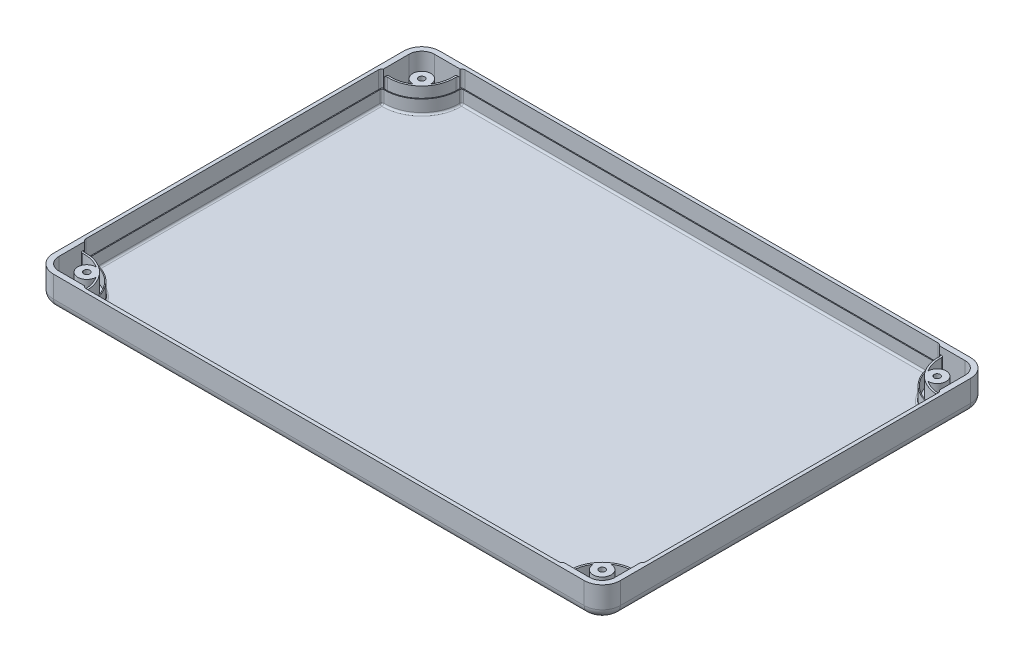
from build123d import *

# Parameters (mm, degrees)
SALIENTE_EXTRUIR1_DEPTH  = 1
SALIENTE_EXTRUIR2_DEPTH  = 16
CROQUIS8_R               = 5
CROQUIS8_R_2             = 1.7
SALIENTE_EXTRUIR7_DEPTH  = 12
SALIENTE_EXTRUIR11_DEPTH = 12
CORTAR_EXTRUIR1_START    = -12
CROQUIS11_R              = 1.7
CORTAR_EXTRUIR1_DEPTH    = 12
CORTAR_EXTRUIR2_DEPTH    = 16
SALIENTE_EXTRUIR12_DEPTH = 7.5
REDONDEO1_R              = 5
REDONDEO2_R              = 1


with BuildPart() as part:
    # Croquis1 → Saliente-Extruir1 (new body)
    with BuildSketch(Plane(origin=(0, 0, 0), x_dir=(1, 0, 0), z_dir=(0, 1, 0))):
        with BuildLine():
            Line((-147, 107), (147, 107))
            ThreePointArc((147, 107), (154.071067812, 104.071067812), (157, 97))
            Line((157, 97), (157, -97))
            ThreePointArc((157, -97), (154.071067812, -104.071067812), (147, -107))
            Line((147, -107), (-147, -107))
            ThreePointArc((-147, -107), (-154.071067812, -104.071067812), (-157, -97))
            Line((-157, -97), (-157, 97))
            ThreePointArc((-157, 97), (-154.071067812, 104.071067812), (-147, 107))
        make_face()
    extrude(amount=SALIENTE_EXTRUIR1_DEPTH)

    # Croquis2 → Saliente-Extruir2 (add)
    with BuildSketch(Plane(origin=(0, 1, 0), x_dir=(1, 0, 0), z_dir=(0, 1, 0))):
        with BuildLine():
            Line((-147, 107), (147, 107))
            ThreePointArc((147, 107), (154.071067812, 104.071067812), (157, 97))
            Line((157, 97), (157, -97))
            ThreePointArc((157, -97), (154.071067812, -104.071067812), (147, -107))
            Line((147, -107), (-147, -107))
            ThreePointArc((-147, -107), (-154.071067812, -104.071067812), (-157, -97))
            Line((-157, -97), (-157, 97))
            ThreePointArc((-157, 97), (-154.071067812, 104.071067812), (-147, 107))
        make_face()
        with BuildLine():
            Line((-154, 97), (-154, -97))
            ThreePointArc((-154, -97), (-151.949747468, -101.949747468), (-147, -104))
            Line((-147, -104), (147, -104))
            ThreePointArc((147, -104), (151.949747468, -101.949747468), (154, -97))
            Line((154, -97), (154, 97))
            ThreePointArc((154, 97), (151.949747468, 101.949747468), (147, 104))
            Line((147, 104), (-147, 104))
            ThreePointArc((-147, 104), (-151.949747468, 101.949747468), (-154, 97))
        make_face(mode=Mode.SUBTRACT)
    extrude(amount=SALIENTE_EXTRUIR2_DEPTH)

    # Croquis8 → Saliente-Extruir7 (add)
    # profile 1 of 4: a face of its own
    with BuildSketch(Plane(origin=(0, 1, 0), x_dir=(1, 0, 0), z_dir=(0, 1, 0))):
        with Locations(Location((-142.725755776, 92.789071879, 0), (0, 0, 90))):
            Circle(CROQUIS8_R)
        with Locations(Location((-142.725755776, 92.789071879, 0), (0, 0, 270))):
            Circle(CROQUIS8_R_2, mode=Mode.SUBTRACT)
    # profile 2 of 4: a face of its own
    with BuildSketch(Plane(origin=(0, 1, 0), x_dir=(1, 0, 0), z_dir=(0, 1, 0))):
        with Locations(Location((142.725755776, 92.789071879, 0), (0, 0, 90))):
            Circle(CROQUIS8_R)
        with Locations(Location((142.725755776, 92.789071879, 0), (0, 0, 90))):
            Circle(CROQUIS8_R_2, mode=Mode.SUBTRACT)
    # profile 3 of 4: a face of its own
    with BuildSketch(Plane(origin=(0, 1, 0), x_dir=(1, 0, 0), z_dir=(0, 1, 0))):
        with Locations(Location((142.725755776, -92.789071879, 0), (0, 0, 90))):
            Circle(CROQUIS8_R)
        with Locations(Location((142.725755776, -92.789071879, 0), (0, 0, 270))):
            Circle(CROQUIS8_R_2, mode=Mode.SUBTRACT)
    # profile 4 of 4: a face of its own
    with BuildSketch(Plane(origin=(0, 1, 0), x_dir=(1, 0, 0), z_dir=(0, 1, 0))):
        with Locations(Location((-142.725755776, -92.789071879, 0), (0, 0, 90))):
            Circle(CROQUIS8_R)
        with Locations(Location((-142.725755776, -92.789071879, 0), (0, 0, 90))):
            Circle(CROQUIS8_R_2, mode=Mode.SUBTRACT)
    extrude(amount=SALIENTE_EXTRUIR7_DEPTH)

    # Croquis10 → Saliente-Extruir11 (add)
    with BuildSketch(Plane(origin=(0, 1, 0), x_dir=(1, 0, 0), z_dir=(0, 1, 0))):
        with BuildLine():
            ThreePointArc((-152.944723551, 83.977267879), (-145.494930604, 85.14691023), (-139.178067155, 89.265734618))
            ThreePointArc((-139.178067155, 89.265734618), (-140.718192191, 88.209804639), (-142.538330048, 87.792585954))
            ThreePointArc((-142.538330048, 87.792585954), (-147.511107859, 85.539431249), (-152.941652637, 84.978709665))
            ThreePointArc((-152.941652637, 84.978709665), (-153.68616785, 84.707856573), (-154, 83.980413323))
            Line((-154, 83.980413323), (-154, 82.978796791))
            ThreePointArc((-154, 82.978796791), (-153.687285803, 83.705183894), (-152.944723551, 83.977267879))
        make_face()
        with BuildLine():
            Line((-132.978796791, 104), (-133.980413323, 104))
            ThreePointArc((-133.980413323, 104), (-134.707856573, 103.68616785), (-134.978709665, 102.941652637))
            ThreePointArc((-134.978709665, 102.941652637), (-135.524242151, 97.567650359), (-137.728097416, 92.636065609))
            ThreePointArc((-137.728097416, 92.636065609), (-138.132769656, 90.81309655), (-139.178067155, 89.265734618))
            ThreePointArc((-139.178067155, 89.265734618), (-135.124780111, 95.552836228), (-133.977267879, 102.944723551))
            ThreePointArc((-133.977267879, 102.944723551), (-133.705183894, 103.687285803), (-132.978796791, 104))
        make_face()
        with BuildLine():
            ThreePointArc((134.978709665, 102.941652637), (134.707856573, 103.68616785), (133.980413323, 104))
            Line((133.980413323, 104), (132.978796791, 104))
            ThreePointArc((132.978796791, 104), (133.705183894, 103.687285803), (133.977267879, 102.944723551))
            ThreePointArc((133.977267879, 102.944723551), (135.124780111, 95.552836228), (139.178067155, 89.265734618))
            ThreePointArc((139.178067155, 89.265734618), (138.132769656, 90.81309655), (137.728097416, 92.636065609))
            ThreePointArc((137.728097416, 92.636065609), (135.524242151, 97.567650359), (134.978709665, 102.941652637))
        make_face()
        with BuildLine():
            ThreePointArc((142.538330048, 87.792585954), (140.718192191, 88.209804639), (139.178067155, 89.265734618))
            ThreePointArc((139.178067155, 89.265734618), (145.494930604, 85.14691023), (152.944723551, 83.977267879))
            ThreePointArc((152.944723551, 83.977267879), (153.687285803, 83.705183894), (154, 82.978796791))
            Line((154, 82.978796791), (154, 83.980413323))
            ThreePointArc((154, 83.980413323), (153.68616785, 84.707856573), (152.941652637, 84.978709665))
            ThreePointArc((152.941652637, 84.978709665), (147.511107859, 85.539431249), (142.538330048, 87.792585954))
        make_face()
        with BuildLine():
            ThreePointArc((152.944723551, -83.977267879), (145.494930604, -85.14691023), (139.178067155, -89.265734618))
            ThreePointArc((139.178067155, -89.265734618), (140.718192191, -88.209804639), (142.538330048, -87.792585954))
            ThreePointArc((142.538330048, -87.792585954), (147.511107859, -85.539431249), (152.941652637, -84.978709665))
            ThreePointArc((152.941652637, -84.978709665), (153.68616785, -84.707856573), (154, -83.980413323))
            Line((154, -83.980413323), (154, -82.978796791))
            ThreePointArc((154, -82.978796791), (153.687285803, -83.705183894), (152.944723551, -83.977267879))
        make_face()
        with BuildLine():
            Line((132.978796791, -104), (133.980413323, -104))
            ThreePointArc((133.980413323, -104), (134.707856573, -103.68616785), (134.978709665, -102.941652637))
            ThreePointArc((134.978709665, -102.941652637), (135.524242151, -97.567650359), (137.728097416, -92.636065609))
            ThreePointArc((137.728097416, -92.636065609), (138.132769656, -90.81309655), (139.178067155, -89.265734618))
            ThreePointArc((139.178067155, -89.265734618), (135.124780111, -95.552836228), (133.977267879, -102.944723551))
            ThreePointArc((133.977267879, -102.944723551), (133.705183894, -103.687285803), (132.978796791, -104))
        make_face()
        with BuildLine():
            ThreePointArc((-134.978709665, -102.941652637), (-134.707856573, -103.68616785), (-133.980413323, -104))
            Line((-133.980413323, -104), (-132.978796791, -104))
            ThreePointArc((-132.978796791, -104), (-133.705183894, -103.687285803), (-133.977267879, -102.944723551))
            ThreePointArc((-133.977267879, -102.944723551), (-135.124780111, -95.552836228), (-139.178067155, -89.265734618))
            ThreePointArc((-139.178067155, -89.265734618), (-138.132769656, -90.81309655), (-137.728097416, -92.636065609))
            ThreePointArc((-137.728097416, -92.636065609), (-135.524242151, -97.567650359), (-134.978709665, -102.941652637))
        make_face()
        with BuildLine():
            ThreePointArc((-142.538330048, -87.792585954), (-140.718192191, -88.209804639), (-139.178067155, -89.265734618))
            ThreePointArc((-139.178067155, -89.265734618), (-145.494930604, -85.14691023), (-152.944723551, -83.977267879))
            ThreePointArc((-152.944723551, -83.977267879), (-153.687285803, -83.705183894), (-154, -82.978796791))
            Line((-154, -82.978796791), (-154, -83.980413323))
            ThreePointArc((-154, -83.980413323), (-153.68616785, -84.707856573), (-152.941652637, -84.978709665))
            ThreePointArc((-152.941652637, -84.978709665), (-147.511107859, -85.539431249), (-142.538330048, -87.792585954))
        make_face()
    extrude(amount=SALIENTE_EXTRUIR11_DEPTH)

    # Croquis11 → Cortar-Extruir1 (cut)
    with BuildSketch(Plane(origin=(0, 1, 0), x_dir=(1, 0, 0), z_dir=(0, 1, 0)).offset(CORTAR_EXTRUIR1_START)):
        with Locations(Location((142.725755776, 92.789071879, 0), (0, 0, 90))):
            Circle(CROQUIS11_R)
        with Locations(Location((-142.725755776, 92.789071879, 0), (0, 0, 90))):
            Circle(CROQUIS11_R)
        with Locations(Location((-142.725755776, -92.789071879, 0), (0, 0, 90))):
            Circle(CROQUIS11_R)
        with Locations(Location((142.725755776, -92.789071879, 0), (0, 0, 90))):
            Circle(CROQUIS11_R)
    extrude(amount=CORTAR_EXTRUIR1_DEPTH, mode=Mode.SUBTRACT)

    # Croquis13 → Cortar-Extruir2 (cut)
    with BuildSketch(Plane(origin=(0, 1, 0), x_dir=(1, 0, 0), z_dir=(0, 1, 0))):
        with BuildLine():
            Line((-130.976026539, -105), (130.976026539, -105))
            ThreePointArc((130.976026539, -105), (132.425172512, -104.378396151), (132.97352377, -102.899975949))
            ThreePointArc((132.97352377, -102.899975949), (138.514718626, -88.514718626), (152.899975949, -82.97352377))
            ThreePointArc((152.899975949, -82.97352377), (154.378396151, -82.425172512), (155, -80.976026539))
            Line((155, -80.976026539), (155, 80.976026539))
            ThreePointArc((155, 80.976026539), (154.378396151, 82.425172512), (152.899975949, 82.97352377))
            ThreePointArc((152.899975949, 82.97352377), (138.514718626, 88.514718626), (132.97352377, 102.899975949))
            ThreePointArc((132.97352377, 102.899975949), (132.425172512, 104.378396151), (130.976026539, 105))
            Line((130.976026539, 105), (-130.976026539, 105))
            ThreePointArc((-130.976026539, 105), (-132.425172512, 104.378396151), (-132.97352377, 102.899975949))
            ThreePointArc((-132.97352377, 102.899975949), (-138.514718626, 88.514718626), (-152.899975949, 82.97352377))
            ThreePointArc((-152.899975949, 82.97352377), (-154.378396151, 82.425172512), (-155, 80.976026539))
            Line((-155, 80.976026539), (-155, -80.976026539))
            ThreePointArc((-155, -80.976026539), (-154.378396151, -82.425172512), (-152.899975949, -82.97352377))
            ThreePointArc((-152.899975949, -82.97352377), (-138.514718626, -88.514718626), (-132.97352377, -102.899975949))
            ThreePointArc((-132.97352377, -102.899975949), (-132.425172512, -104.378396151), (-130.976026539, -105))
        make_face()
    extrude(amount=CORTAR_EXTRUIR2_DEPTH, mode=Mode.SUBTRACT)

    # Croquis14 → Saliente-Extruir12 (add)
    with BuildSketch(Plane(origin=(0, 1, 0), x_dir=(1, 0, 0), z_dir=(0, 1, 0))):
        with BuildLine():
            Line((154, 80.976026539), (154, -80.976026539))
            ThreePointArc((154, -80.976026539), (153.689198076, -81.700599525), (152.949987975, -81.974775155))
            ThreePointArc((152.949987975, -81.974775155), (137.807611845, -87.807611845), (131.974775155, -102.949987975))
            ThreePointArc((131.974775155, -102.949987975), (131.700599525, -103.689198076), (130.976026539, -104))
            Line((130.976026539, -104), (-130.976026539, -104))
            ThreePointArc((-130.976026539, -104), (-131.700599525, -103.689198076), (-131.974775155, -102.949987975))
            ThreePointArc((-131.974775155, -102.949987975), (-137.807611845, -87.807611845), (-152.949987975, -81.974775155))
            ThreePointArc((-152.949987975, -81.974775155), (-153.689198076, -81.700599525), (-154, -80.976026539))
            Line((-154, -80.976026539), (-154, 80.976026539))
            ThreePointArc((-154, 80.976026539), (-153.689198076, 81.700599525), (-152.949987975, 81.974775155))
            ThreePointArc((-152.949987975, 81.974775155), (-137.807611845, 87.807611845), (-131.974775155, 102.949987975))
            ThreePointArc((-131.974775155, 102.949987975), (-131.700599525, 103.689198076), (-130.976026539, 104))
            Line((-130.976026539, 104), (130.976026539, 104))
            ThreePointArc((130.976026539, 104), (131.700599525, 103.689198076), (131.974775155, 102.949987975))
            ThreePointArc((131.974775155, 102.949987975), (137.807611845, 87.807611845), (152.949987975, 81.974775155))
            ThreePointArc((152.949987975, 81.974775155), (153.689198076, 81.700599525), (154, 80.976026539))
        make_face()
        with BuildLine():
            ThreePointArc((152.474406859, 81.456462409), (137.454058454, 87.454058454), (131.456462409, 102.47440686))
            ThreePointArc((131.456462409, 102.47440686), (131.172888124, 103.197999592), (130.456789967, 103.500000001))
            Line((130.456789967, 103.500000001), (-130.456789967, 103.500000001))
            ThreePointArc((-130.456789967, 103.500000001), (-131.172888124, 103.197999592), (-131.456462409, 102.47440686))
            ThreePointArc((-131.456462409, 102.47440686), (-137.454058454, 87.454058454), (-152.474406859, 81.456462409))
            ThreePointArc((-152.474406859, 81.456462409), (-153.197999591, 81.172888124), (-153.5, 80.456789967))
            Line((-153.5, 80.456789967), (-153.5, -80.456789967))
            ThreePointArc((-153.5, -80.456789967), (-153.197999591, -81.172888124), (-152.474406859, -81.456462409))
            ThreePointArc((-152.474406859, -81.456462409), (-137.454058454, -87.454058454), (-131.456462409, -102.474406858))
            ThreePointArc((-131.456462409, -102.474406858), (-131.172888124, -103.197999591), (-130.456789967, -103.499999999))
            Line((-130.456789967, -103.499999999), (130.456789967, -103.499999999))
            ThreePointArc((130.456789967, -103.499999999), (131.172888124, -103.197999591), (131.456462409, -102.474406858))
            ThreePointArc((131.456462409, -102.474406858), (137.454058454, -87.454058454), (152.474406859, -81.456462409))
            ThreePointArc((152.474406859, -81.456462409), (153.197999591, -81.172888124), (153.5, -80.456789967))
            Line((153.5, -80.456789967), (153.5, 80.456789967))
            ThreePointArc((153.5, 80.456789967), (153.197999591, 81.172888124), (152.474406859, 81.456462409))
        make_face(mode=Mode.SUBTRACT)
    extrude(amount=SALIENTE_EXTRUIR12_DEPTH)

    # Redondeo1
    redondeo1_edges = [part.edges().sort_by_distance(p)[0] for p in [
        (0, 0, 107),
        (-154.071067812, 0, 104.071067812),
        (-157, 0, 0),
        (-154.071067812, 0, -104.071067812),
        (0, 0, -107),
        (154.071067812, 0, -104.071067812),
        (157, 0, 0),
        (154.071067812, 0, 104.071067812),
    ]]
    fillet(redondeo1_edges, radius=REDONDEO1_R)

    # Redondeo2
    redondeo2_edges = [part.edges().sort_by_distance(p)[0] for p in [
        (153.197999591, 1, -81.172888124),
        (153.5, 1, 0),
        (153.197999591, 1, 81.172888124),
        (137.454058454, 1, 87.454058454),
        (-131.172888124, 1, 103.197999591),
        (-153.197999591, 1, 81.172888124),
        (-153.197999591, 1, -81.172888124),
        (-137.454058454, 1, -87.454058454),
        (0, 1, -103.500000001),
        (137.454058454, 1, -87.454058454),
        (131.172888124, 1, -103.197999592),
        (-131.172888124, 1, -103.197999592),
        (-153.5, 1, 0),
        (-137.454058454, 1, 87.454058454),
        (0, 1, 103.499999999),
        (131.172888124, 1, 103.197999591),
    ]]
    fillet(redondeo2_edges, radius=REDONDEO2_R)


solid = part.part
